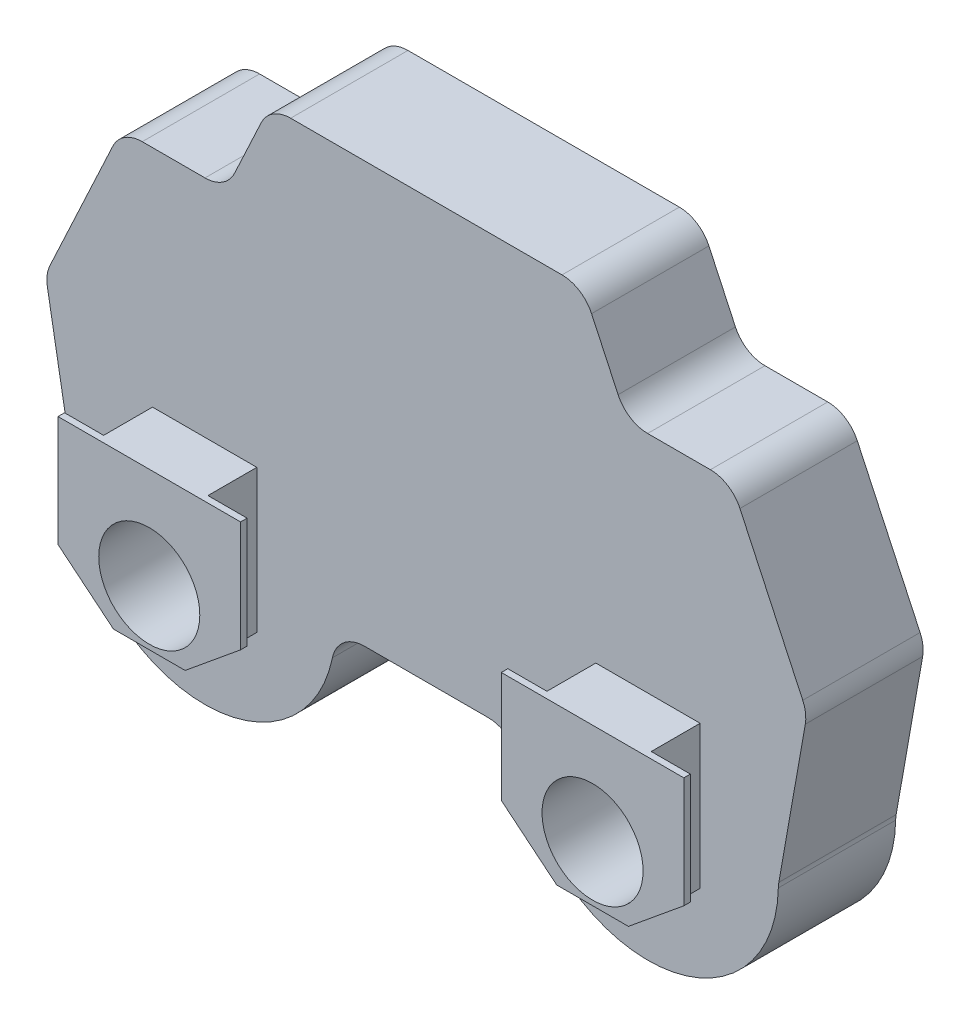
from build123d import *

# Parameters (mm, degrees)
CROQUIS1_R                 = 5.5
SALIENTE_EXTRUIR1_DEPTH    = 18
CORTAR_EXTRUIR1_DEPTH      = 89.71111533
CORTAR_EXTRUIR1_DEPTH_BACK = 89.71111533
CROQUIS2_R                 = 7.75
CROQUIS2_R_2               = 5.5
SALIENTE_EXTRUIR2_START    = 8.5
CROQUIS2_6_R               = 7.75
SALIENTE_EXTRUIR2_DEPTH    = 8.5
CROQUIS4_W                 = 7.5
CROQUIS4_H                 = 22.982035645
CORTAR_EXTRUIR2_DEPTH      = 6
CROQUIS5_W                 = 7.5
CROQUIS5_H                 = 22.982035645
CORTAR_EXTRUIR3_DEPTH      = 6


with BuildPart() as part:
    # Croquis1 → Saliente-Extruir1 (new body)
    with BuildSketch(Plane.XY):
        with BuildLine():
            Line((-9.505102572, 0), (9.505102572, 0))
            ThreePointArc((9.505102572, 0), (12.667380232, -1.127016654), (14.404082058, -4))
            ThreePointArc((14.404082058, -4), (35.826374721, -19.916434304), (53.996590294, -0.369292059))
            ThreePointArc((53.996590294, -0.369292059), (54.019000089, 0.020132875), (54.071699102, 0.406625814))
            Line((54.071699102, 0.406625814), (58.134419217, 23.447456541))
            ThreePointArc((58.134419217, 23.447456541), (58.167604759, 24.96832839), (57.741919387, 26.428788738))
            Line((57.741919387, 26.428788738), (48.108079819, 47.088624363))
            ThreePointArc((48.108079819, 47.088624363), (46.263038926, 49.192490284), (43.576540884, 49.975533055))
            Line((43.576540884, 49.975533055), (33.947243492, 49.975533055))
            ThreePointArc((33.947243492, 49.975533055), (31.26074545, 50.758575826), (29.415704557, 52.862441746))
            Line((29.415704557, 52.862441746), (25.346187631, 61.589548956))
            ThreePointArc((25.346187631, 61.589548956), (23.501146738, 63.693414876), (20.814648696, 64.476457647))
            Line((20.814648696, 64.476457647), (-20.814648696, 64.476457647))
            ThreePointArc((-20.814648696, 64.476457647), (-23.501146738, 63.693414876), (-25.346187631, 61.589548956))
            Line((-25.346187631, 61.589548956), (-29.415704557, 52.862441746))
            ThreePointArc((-29.415704557, 52.862441746), (-31.26074545, 50.758575826), (-33.947243492, 49.975533055))
            Line((-33.947243492, 49.975533055), (-43.576540884, 49.975533055))
            ThreePointArc((-43.576540884, 49.975533055), (-46.263038926, 49.192490284), (-48.108079819, 47.088624363))
            Line((-48.108079819, 47.088624363), (-57.741919387, 26.428788738))
            ThreePointArc((-57.741919387, 26.428788738), (-58.167604759, 24.96832839), (-58.134419217, 23.447456541))
            Line((-58.134419217, 23.447456541), (-54.071699102, 0.406625814))
            ThreePointArc((-54.071699102, 0.406625814), (-54.019000089, 0.020132875), (-53.996590294, -0.369292059))
            ThreePointArc((-53.996590294, -0.369292059), (-35.826374721, -19.916434304), (-14.404082058, -4))
            ThreePointArc((-14.404082058, -4), (-12.667380232, -1.127016654), (-9.505102572, 0))
        make_face()
        with Locations((34, 0)):
            Circle(CROQUIS1_R, mode=Mode.SUBTRACT)
        with Locations((-34, 0)):
            Circle(CROQUIS1_R, mode=Mode.SUBTRACT)
    extrude(amount=SALIENTE_EXTRUIR1_DEPTH)

    # Croquis2 → Cortar-Extruir1 (cut, two sides: drawn at the far end of the back side and taken through both)
    # profile 1 of 2: a face of its own
    with BuildSketch(Plane.XY.offset(18).offset(-CORTAR_EXTRUIR1_DEPTH_BACK)):
        with Locations((34, 0)):
            Circle(CROQUIS2_R)
        with Locations((34, 0)):
            Circle(CROQUIS2_R_2, mode=Mode.SUBTRACT)
    # profile 2 of 2: a face of its own
    with BuildSketch(Plane.XY.offset(18).offset(-CORTAR_EXTRUIR1_DEPTH_BACK)):
        with Locations((-34, 0)):
            Circle(CROQUIS2_R)
        with Locations((-34, 0)):
            Circle(CROQUIS2_R_2, mode=Mode.SUBTRACT)
    extrude(amount=CORTAR_EXTRUIR1_DEPTH + CORTAR_EXTRUIR1_DEPTH_BACK, mode=Mode.SUBTRACT)

    # Croquis2<6> → Saliente-Extruir2 (add)
    # profile 1 of 2: a face of its own
    with BuildSketch(Plane.XY.offset(18).offset(SALIENTE_EXTRUIR2_START)):
        Polygon((-48.000069308, 15.502035645), (-19.999930692, 15.502035645), (-19.999930692, -1.497964355), (-28.5, -8.48), (-39.5, -8.48), (-48.000069308, -1.497964355), align=None)
        with Locations((-34, 0)):
            Circle(CROQUIS2_6_R, mode=Mode.SUBTRACT)
    # profile 2 of 2: a face of its own
    with BuildSketch(Plane.XY.offset(18).offset(SALIENTE_EXTRUIR2_START)):
        Polygon((19.999930692, -1.497964355), (19.999930692, 15.502035645), (48.000069308, 15.502035645), (48.000069308, -1.497964355), (39.5, -8.48), (28.5, -8.48), align=None)
        with Locations((34, 0)):
            Circle(CROQUIS2_6_R, mode=Mode.SUBTRACT)
    extrude(amount=-SALIENTE_EXTRUIR2_DEPTH)

    # Croquis4 → Cortar-Extruir2 (cut)
    with BuildSketch(Plane.ZY.offset(-19.999930692)):
        with Locations((21.75, 4.011017823)):
            Rectangle(CROQUIS4_W, CROQUIS4_H)
    cortar_extruir2 = extrude(amount=-CORTAR_EXTRUIR2_DEPTH, mode=Mode.SUBTRACT)

    # Croquis5 → Cortar-Extruir3 (cut)
    with BuildSketch(Plane(origin=(48.000069308, 0, 0), x_dir=(0, 0, -1), z_dir=(1, 0, 0))):
        with Locations((-21.75, 4.011017823)):
            Rectangle(CROQUIS5_W, CROQUIS5_H)
    cortar_extruir3 = extrude(amount=-CORTAR_EXTRUIR3_DEPTH, mode=Mode.SUBTRACT)

    # Simetría1: Cortar-Extruir2, Cortar-Extruir3 across plane
    add(cortar_extruir2.mirror(Plane(origin=(0, 0, 0), x_dir=(0, 0, 1), z_dir=(1, 0, 0))), mode=Mode.SUBTRACT)
    add(cortar_extruir3.mirror(Plane(origin=(0, 0, 0), x_dir=(0, 0, 1), z_dir=(1, 0, 0))), mode=Mode.SUBTRACT)


solid = part.part
